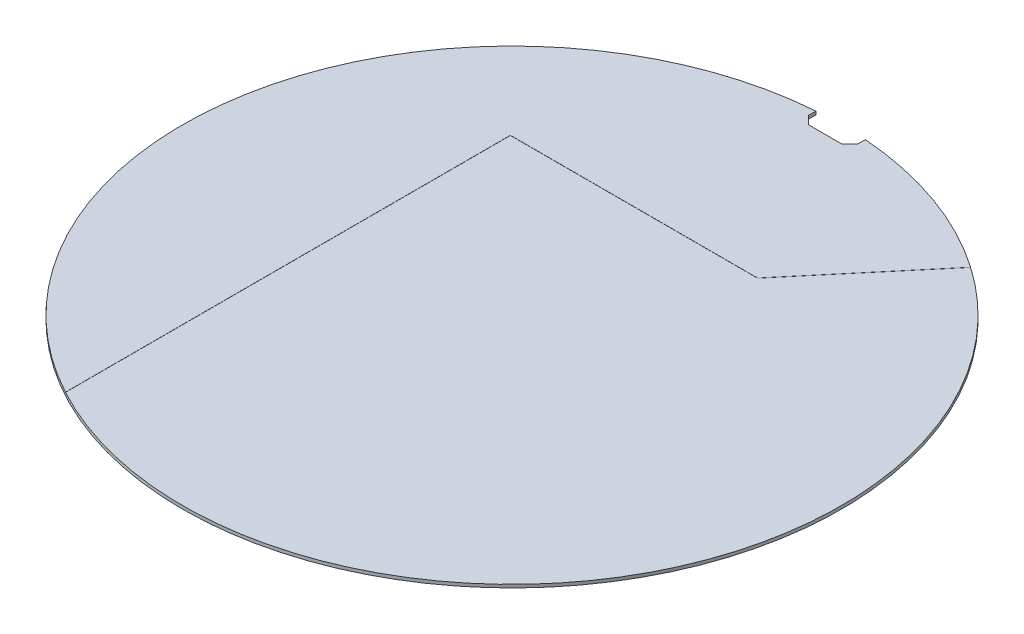
from build123d import *

# Parameters (mm, degrees)
SKETCH1_R           = 20
BOSS_EXTRUDE1_DEPTH = 0.2
CUT_EXTRUDE1_DEPTH  = 29.284978345
CUT_EXTRUDE2_START  = -0.01
CUT_EXTRUDE2_DEPTH  = 0.01


with BuildPart() as part:
    # Sketch1 → Boss-Extrude1 (new body)
    with BuildSketch(Plane(origin=(0, 0, 0), x_dir=(1, 0, 0), z_dir=(0, 1, 0))):
        with Locations(Location((0, 0, 0), (0, 0, 270))):
            Circle(SKETCH1_R)
    extrude(amount=BOSS_EXTRUDE1_DEPTH)

    # Sketch2 → Cut-Extrude1 (cut, through all)
    with BuildSketch(Plane(origin=(0, 0.2, 0), x_dir=(1, 0, 0), z_dir=(0, 1, 0))):
        with BuildLine():
            Line((1.5, 19.5), (1.5, 19.943670675))
            ThreePointArc((1.5, 19.943670675), (0, 20), (-1.5, 19.943670675))
            Line((-1.5, 19.943670675), (-1.5, 19.5))
            Line((-1.5, 19.5), (-1, 19))
            Line((-1, 19), (1, 19))
            Line((1, 19), (1.5, 19.5))
        make_face()
    extrude(amount=-CUT_EXTRUDE1_DEPTH, mode=Mode.SUBTRACT)

    # Sketch3 → Cut-Extrude2 (cut)
    with BuildSketch(Plane(origin=(0, 0.2, 0), x_dir=(1, 0, 0), z_dir=(0, 1, 0)).offset(CUT_EXTRUDE2_START)):
        with BuildLine():
            ThreePointArc((-9.5, -17.599715907), (17.042589511, -10.466620408), (11.400670136, 16.432428927))
            Line((11.400670136, 16.432428927), (5.5, 9.400284093))
            Line((5.5, 9.400284093), (-9.5, 9.400284093))
            Line((-9.5, 9.400284093), (-9.5, -17.599715907))
        make_face()
    extrude(amount=CUT_EXTRUDE2_DEPTH, mode=Mode.SUBTRACT)


solid = part.part
